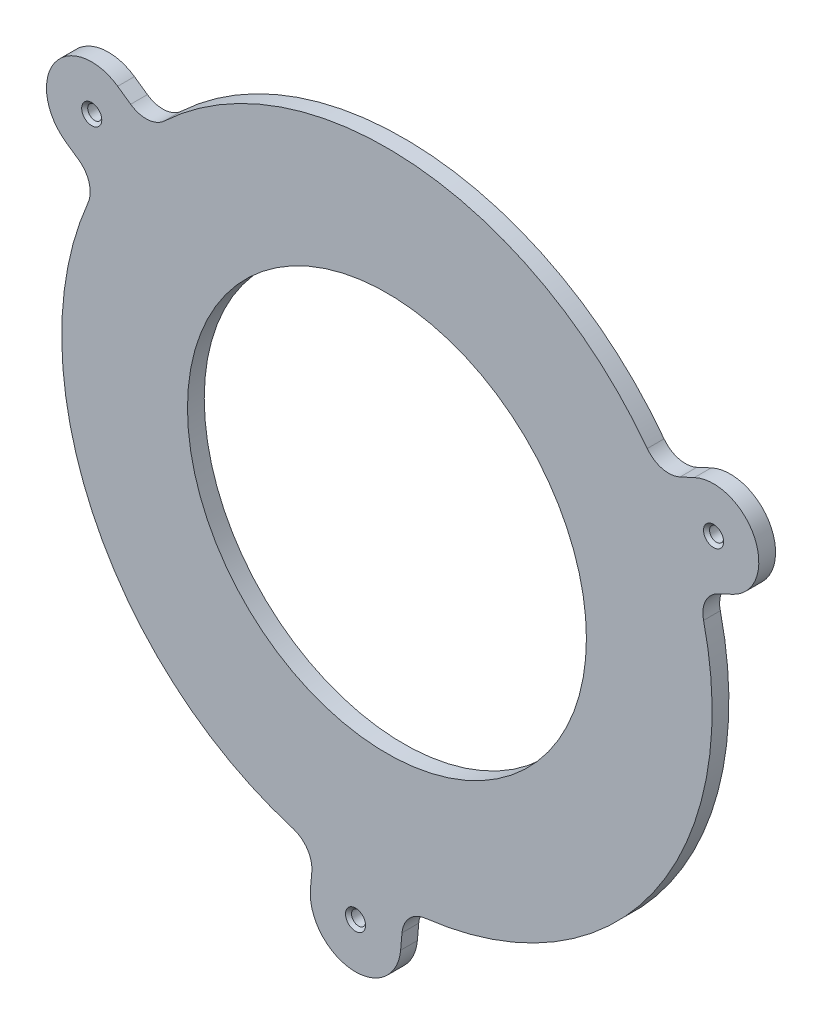
from build123d import *

# Parameters (mm, degrees)
SKETCH1_R                = 97
SKETCH1_R_2              = 59.5
BASE_DEPTH               = 5
TANG_START               = -5
TANG_DEPTH               = 5
FILLET1_R                = 8
CIRPATTERN1_COUNT        = 3
FILLET1_OF_CIRPATTERN1_R = 8


with BuildPart() as part:
    # Sketch1 → Base (new body)
    with BuildSketch(Plane.XY):
        Circle(SKETCH1_R)
        Circle(SKETCH1_R_2, mode=Mode.SUBTRACT)
    extrude(amount=BASE_DEPTH)

    # Sketch2 → Tang (add)
    with BuildSketch(Plane.XY.offset(5).offset(TANG_START)):
        with BuildLine():
            Line((-95.802126652, 50.60091431), (-86.427728757, 44.036890238))
            ThreePointArc((-86.427728757, 44.036890238), (-79.457748296, 55.636914326), (-70.941164976, 66.153995434))
            Line((-70.941164976, 66.153995434), (-80.31556287, 72.718019506))
            ThreePointArc((-80.31556287, 72.718019506), (-99.117397359, 69.402748798), (-95.802126652, 50.60091431))
        make_face()
    tang = extrude(amount=TANG_DEPTH)

    # Fillet1
    fillet1_edges = [part.edges().sort_by_distance(p)[0] for p in [
        (-70.941164976, 66.153995434, 2.5),
        (-86.427728757, 44.036890238, 2.5),
    ]]
    fillet(fillet1_edges, radius=FILLET1_R)

    # Sketch3 → M5x0.8 Tapped Hole1 (revolve, cut)
    with BuildSketch(Plane(origin=(-88.058844761, 61.659466908, 5), x_dir=(0, -1, 0), z_dir=(1, 0, 0))):
        Polygon((0, 0), (0, 5), (3, 5), (2.1, 4.1), (2.1, 0.9), (3, 0), align=None)
    m5x0_8_tapped_hole1 = revolve(axis=Axis((-88.058844761, 61.659466908, 11.35), (0, 0, -1)), mode=Mode.SUBTRACT)

    # CirPattern1: Tang, M5x0.8 Tapped Hole1 ×3 about axis
    cirpattern1_axis = Axis((0, 0, 0), (0, 0, 1))
    add([tang.rotate(cirpattern1_axis, i * 360 / CIRPATTERN1_COUNT) for i in range(1, CIRPATTERN1_COUNT)])
    add([m5x0_8_tapped_hole1.rotate(cirpattern1_axis, i * 360 / CIRPATTERN1_COUNT) for i in range(1, CIRPATTERN1_COUNT)], mode=Mode.SUBTRACT)

    # Fillet1 of CirPattern1
    fillet1_of_cirpattern1_edges = [part.edges().sort_by_distance(p)[0] for p in [
        (-21.82045812, -94.51384876, 2.5),
        (5.076798729, -96.867053814, 2.5),
        (92.761623095, 28.359853326, 2.5),
        (81.350930028, 52.830163576, 2.5),
    ]]
    fillet(fillet1_of_cirpattern1_edges, radius=FILLET1_OF_CIRPATTERN1_R)


solid = part.part
